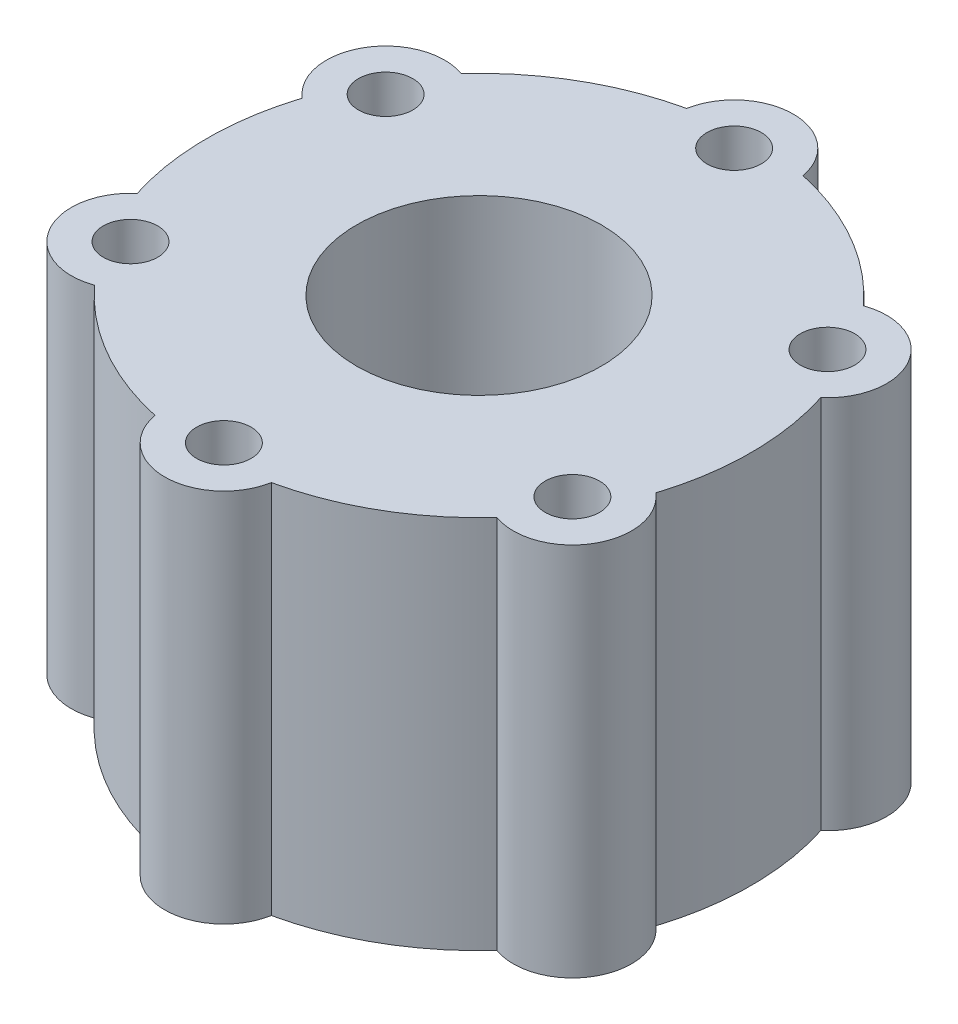
from build123d import *

# Parameters (mm, degrees)
SKETCH1_R           = 2.54
SKETCH1_R_2         = 15.875
BOSS_EXTRUDE1_DEPTH = 4.699
SKETCH2_R           = 11.426
SKETCH2_R_2         = 2.54
BOSS_EXTRUDE2_DEPTH = 30.301


with BuildPart() as part:
    # Sketch1 → Boss-Extrude1 (new body)
    with BuildSketch(Plane(origin=(0, 0, 0), x_dir=(1, 0, 0), z_dir=(0, 1, 0))):
        with BuildLine():
            ThreePointArc((-5.433318575, 24.812074667), (-12.7, 21.997045256), (-18.771227695, 17.111429246))
            ThreePointArc((-18.771227695, 17.111429246), (-25.406587271, 14.6685), (-24.204546269, 7.700645421))
            ThreePointArc((-24.204546269, 7.700645421), (-25.4, 0), (-24.204546269, -7.700645421))
            ThreePointArc((-24.204546269, -7.700645421), (-25.406587271, -14.6685), (-18.771227695, -17.111429246))
            ThreePointArc((-18.771227695, -17.111429246), (-12.7, -21.997045256), (-5.433318575, -24.812074667))
            ThreePointArc((-5.433318575, -24.812074667), (0, -29.337), (5.433318575, -24.812074667))
            ThreePointArc((5.433318575, -24.812074667), (12.7, -21.997045256), (18.771227695, -17.111429246))
            ThreePointArc((18.771227695, -17.111429246), (25.406587271, -14.6685), (24.204546269, -7.700645421))
            ThreePointArc((24.204546269, -7.700645421), (25.4, 0), (24.204546269, 7.700645421))
            ThreePointArc((24.204546269, 7.700645421), (25.406587271, 14.6685), (18.771227695, 17.111429246))
            ThreePointArc((18.771227695, 17.111429246), (12.7, 21.997045256), (5.433318575, 24.812074667))
            ThreePointArc((5.433318575, 24.812074667), (0, 29.337), (-5.433318575, 24.812074667))
        make_face()
        with Locations(Location((0, 23.8125, 0), (0, 0, 270))):
            Circle(SKETCH1_R, mode=Mode.SUBTRACT)
        with Locations(Location((20.622229928, 11.90625, 0), (0, 0, 270))):
            Circle(SKETCH1_R, mode=Mode.SUBTRACT)
        with Locations(Location((20.622229928, -11.90625, 0), (0, 0, 270))):
            Circle(SKETCH1_R, mode=Mode.SUBTRACT)
        with Locations(Location((0, -23.8125, 0), (0, 0, 270))):
            Circle(SKETCH1_R, mode=Mode.SUBTRACT)
        with Locations(Location((-20.622229928, -11.90625, 0), (0, 0, 270))):
            Circle(SKETCH1_R, mode=Mode.SUBTRACT)
        with Locations(Location((-20.622229928, 11.90625, 0), (0, 0, 270))):
            Circle(SKETCH1_R, mode=Mode.SUBTRACT)
        with Locations(Location((0, 0, 0), (0, 0, 270))):
            Circle(SKETCH1_R_2, mode=Mode.SUBTRACT)
    extrude(amount=BOSS_EXTRUDE1_DEPTH)

    # Sketch2 → Boss-Extrude2 (add)
    with BuildSketch(Plane(origin=(0, 4.699, 0), x_dir=(1, 0, 0), z_dir=(0, 1, 0))):
        with BuildLine():
            ThreePointArc((-18.771227695, 17.111429246), (-25.406587271, 14.6685), (-24.204546269, 7.700645421))
            ThreePointArc((-24.204546269, 7.700645421), (-25.4, 0), (-24.204546269, -7.700645421))
            ThreePointArc((-24.204546269, -7.700645421), (-25.406587271, -14.6685), (-18.771227695, -17.111429246))
            ThreePointArc((-18.771227695, -17.111429246), (-12.7, -21.997045256), (-5.433318575, -24.812074667))
            ThreePointArc((-5.433318575, -24.812074667), (0, -29.337), (5.433318575, -24.812074667))
            ThreePointArc((5.433318575, -24.812074667), (12.7, -21.997045256), (18.771227695, -17.111429246))
            ThreePointArc((18.771227695, -17.111429246), (25.406587271, -14.6685), (24.204546269, -7.700645421))
            ThreePointArc((24.204546269, -7.700645421), (25.4, 0), (24.204546269, 7.700645421))
            ThreePointArc((24.204546269, 7.700645421), (25.406587271, 14.6685), (18.771227695, 17.111429246))
            ThreePointArc((18.771227695, 17.111429246), (12.7, 21.997045256), (5.433318575, 24.812074667))
            ThreePointArc((5.433318575, 24.812074667), (0, 29.337), (-5.433318575, 24.812074667))
            ThreePointArc((-5.433318575, 24.812074667), (-12.7, 21.997045256), (-18.771227695, 17.111429246))
        make_face()
        with Locations(Location((0, 0, 0), (0, 0, 90))):
            Circle(SKETCH2_R, mode=Mode.SUBTRACT)
        with Locations(Location((20.622229928, -11.90625, 0), (0, 0, 90))):
            Circle(SKETCH2_R_2, mode=Mode.SUBTRACT)
        with Locations(Location((20.622229928, 11.90625, 0), (0, 0, 90))):
            Circle(SKETCH2_R_2, mode=Mode.SUBTRACT)
        with Locations(Location((0, 23.8125, 0), (0, 0, 90))):
            Circle(SKETCH2_R_2, mode=Mode.SUBTRACT)
        with Locations(Location((-20.622229928, 11.90625, 0), (0, 0, 90))):
            Circle(SKETCH2_R_2, mode=Mode.SUBTRACT)
        with Locations(Location((-20.622229928, -11.90625, 0), (0, 0, 90))):
            Circle(SKETCH2_R_2, mode=Mode.SUBTRACT)
        with Locations(Location((0, -23.8125, 0), (0, 0, 90))):
            Circle(SKETCH2_R_2, mode=Mode.SUBTRACT)
    extrude(amount=BOSS_EXTRUDE2_DEPTH)

    # Sketch3 → Revolve1 (revolve)
    with BuildSketch(Plane.XY, mode=Mode.PRIVATE) as revolve1_sk:
        Polygon((18.415, 2.0748), (18.415, 4.699), (11.426, 4.699), (15.875, 2.0748), align=None)
    revolve(revolve1_sk.sketch.rotate(Axis((0, -0.263075, 0), (0, 1, 0)), 90), axis=Axis((0, -0.263075, 0), (0, 1, 0)))


solid = part.part
